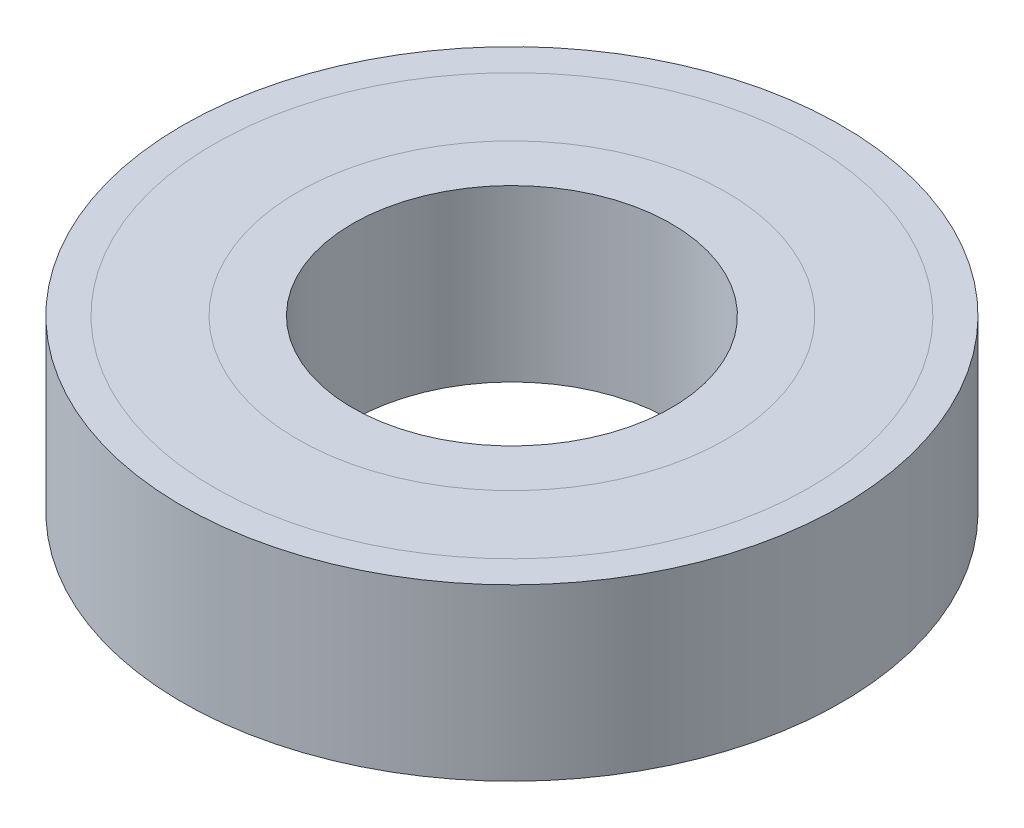
from build123d import *

# Parameters (mm, degrees)
SKETCH1_W = 16
SKETCH1_H = 16


with BuildPart() as part:
    # Sketch1 → Revolve1 (revolve)
    with BuildSketch(Plane.XY, mode=Mode.PRIVATE) as revolve1_sk:
        with Locations((23, 0)):
            Rectangle(SKETCH1_W, SKETCH1_H)
    revolve(revolve1_sk.sketch.rotate(Axis((0, 8, 0), (0, -1, 0)), 180), axis=Axis((0, 8, 0), (0, -1, 0)))


solid = part.part
